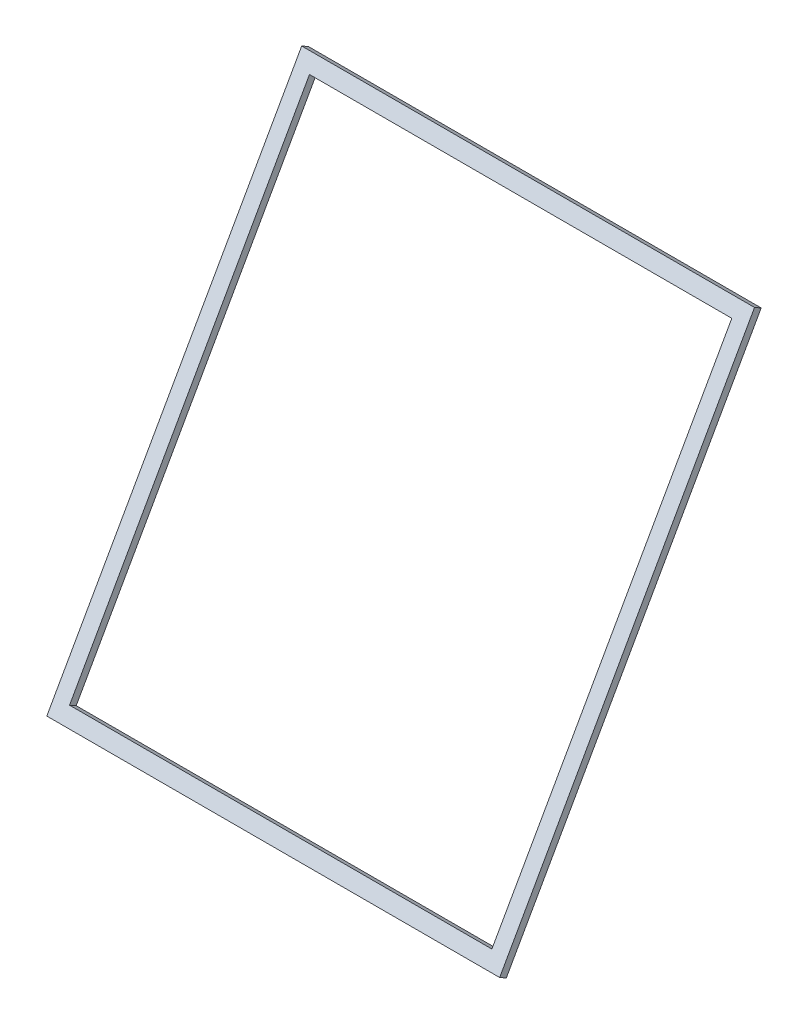
from build123d import *

# Parameters (mm, degrees)
CROQUIS2_W              = 296.787285623
CROQUIS2_H              = 340.570123561
CROQUIS2_W_2            = 276.787285623
CROQUIS2_H_2            = 320.570123561
SALIENTE_EXTRUIR1_DEPTH = 5


with BuildPart() as part:
    # Croquis2 → Saliente-Extruir1 (new body)
    with BuildSketch(Plane(origin=(0, 37.576147441, 66.759652814), x_dir=(-1, 0, 0), z_dir=(0, -0.49049764516922784, -0.8714425167981203))):
        with Locations((7.754092984, -20.861611505)):
            Rectangle(CROQUIS2_W, CROQUIS2_H)
        with Locations((7.754092984, -20.861611505)):
            Rectangle(CROQUIS2_W_2, CROQUIS2_H_2, mode=Mode.SUBTRACT)
    extrude(amount=-SALIENTE_EXTRUIR1_DEPTH)


solid = part.part
